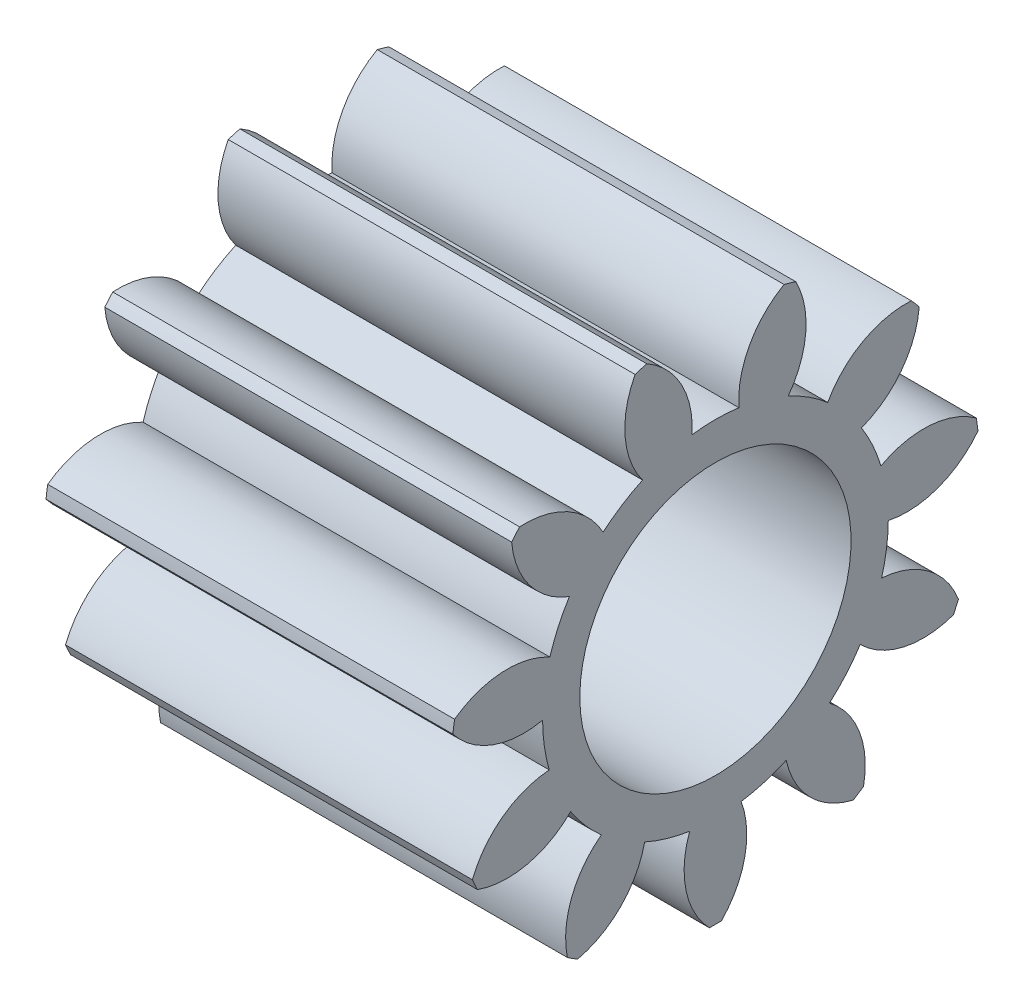
from build123d import *

# Parameters (mm, degrees)
BASPROSKE_W     = 6
BASPROSKE_H     = 3.9
TOOTHCUT_DEPTH  = 9.149846624
TEETHCUTS_COUNT = 11
TEETHCUTS_ANGLE = 327.272727273
BORSKE_R        = 2
BORE_DEPTH      = 50.0000508


with BuildPart() as part:
    # BasProSke → Base-Revolve (revolve)
    with BuildSketch(Plane(origin=(0, 0, 0), x_dir=(1, 0, 0), z_dir=(0, 1, 0)), mode=Mode.PRIVATE) as base_revolve_sk:
        with Locations((3, 1.95)):
            Rectangle(BASPROSKE_W, BASPROSKE_H)
    revolve(base_revolve_sk.sketch.rotate(Axis((-10, 0, 0), (1, 0, 0)), 180), axis=Axis((-10, 0, 0), (1, 0, 0)))

    # TooCutSke → ToothCut (cut, through all)
    with BuildSketch(Plane(origin=(0, 0, 0), x_dir=(0, 0, -1), z_dir=(1, 0, 0))):
        with BuildLine():
            ThreePointArc((0.345926135, 2.525418007), (0, 2.549), (-0.345926135, 2.525418007))
            ThreePointArc((-0.345926135, 2.525418007), (-0.508630204, 3.258246769), (-1.044575138, 3.783864155))
            ThreePointArc((-1.044575138, 3.783864155), (0, 3.9254), (1.044575138, 3.783864155))
            ThreePointArc((1.044575138, 3.783864155), (0.508630204, 3.258246769), (0.345926135, 2.525418007))
        make_face()
    toothcut = extrude(amount=TOOTHCUT_DEPTH, mode=Mode.SUBTRACT)

    # TeethCuts: ToothCut ×11 about axis
    teethcuts_axis = Axis((-10, 0, 0), (1, 0, 0))
    for i in range(1, TEETHCUTS_COUNT):
        add(toothcut.rotate(teethcuts_axis, i * TEETHCUTS_ANGLE / (TEETHCUTS_COUNT - 1)), mode=Mode.SUBTRACT)

    # BorSke → Bore (cut, symmetric)
    with BuildSketch(Plane(origin=(0, 0, 0), x_dir=(0, 0, -1), z_dir=(1, 0, 0))):
        with Locations(Location((0, 0, 0), (0, 0, 180))):
            Circle(BORSKE_R)
    extrude(amount=BORE_DEPTH, both=True, mode=Mode.SUBTRACT)


solid = part.part
